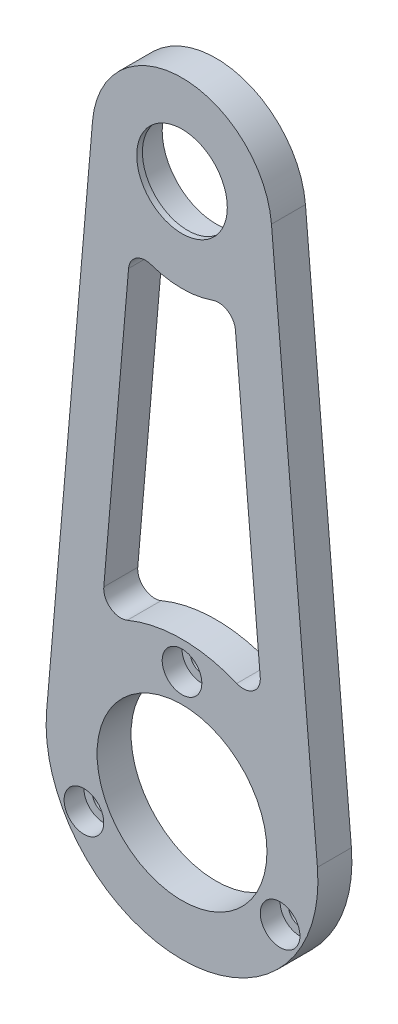
from build123d import *

# Parameters (mm, degrees)
SKETCH_1_R          = 15
SKETCH_1_R_2        = 2
EXTRUDE_1_DEPTH     = 6
FILLET_1_R          = 3
SKETCH_3_R          = 9.5
CUT_EXTRUDE_2_DEPTH = 6
SKETCH_4_R          = 3.5
CUT_EXTRUDE_3_DEPTH = 3.5
EXTRUDE_START       = -1
SKETCH_6_R          = 9.5
SKETCH_6_R_2        = 8
EXTRUDE_3_DEPTH     = 1


with BuildPart() as part:
    # 草图1 → 凸台-拉伸1 (new body)
    with BuildSketch(Plane.XY):
        with BuildLine():
            Line((-23.911674205, 2.057142857), (-15.798784742, 96.359183673))
            ThreePointArc((-15.798784742, 96.359183673), (0, 110.857142857), (15.798784742, 96.359183673))
            Line((15.798784742, 96.359183673), (23.911674205, 2.057142857))
            ThreePointArc((23.911674205, 2.057142857), (0, -24), (-23.911674205, 2.057142857))
        make_face()
        Circle(SKETCH_1_R, mode=Mode.SUBTRACT)
        with Locations((0, 20)):
            Circle(SKETCH_1_R_2, mode=Mode.SUBTRACT)
        with Locations((17.320508076, -10)):
            Circle(SKETCH_1_R_2, mode=Mode.SUBTRACT)
        with Locations((-17.320508076, -10)):
            Circle(SKETCH_1_R_2, mode=Mode.SUBTRACT)
        with BuildLine():
            Line((-14.294598475, 20.510106154), (-9.061440494, 81.338924272))
            ThreePointArc((-9.061440494, 81.338924272), (0, 78.606870528), (9.061440494, 81.338924272))
            Line((9.061440494, 81.338924272), (14.294598475, 20.510106154))
            ThreePointArc((14.294598475, 20.510106154), (0, 25), (-14.294598475, 20.510106154))
        make_face(mode=Mode.SUBTRACT)
    extrude(amount=EXTRUDE_1_DEPTH)

    # 圆角1
    fillet_1_edges = [part.edges().sort_by_distance(p)[0] for p in [
        (-14.294598475, 20.510106154, 3),
        (14.294598475, 20.510106154, 3),
        (9.061440494, 81.338924272, 3),
        (-9.061440494, 81.338924272, 3),
    ]]
    fillet(fillet_1_edges, radius=FILLET_1_R)

    # 草图3 → 切除-拉伸2 (cut)
    with BuildSketch(Plane(origin=(0, 0, 0), x_dir=(-1, 0, 0), z_dir=(0, 0, -1))):
        with Locations((0, 95)):
            Circle(SKETCH_3_R)
    extrude(amount=-CUT_EXTRUDE_2_DEPTH, mode=Mode.SUBTRACT)

    # 草图4 → 切除-拉伸3 (cut)
    with BuildSketch(Plane.XY.offset(6)):
        with Locations((0, 20)):
            Circle(SKETCH_4_R)
        with Locations((17.320508076, -10)):
            Circle(SKETCH_4_R)
        with Locations((-17.320508076, -10)):
            Circle(SKETCH_4_R)
    extrude(amount=-CUT_EXTRUDE_3_DEPTH, mode=Mode.SUBTRACT)

    # 草图6 → 凸台-拉伸3 (add)
    with BuildSketch(Plane.XY.offset(6).offset(EXTRUDE_START)):
        with Locations(Location((0, 95, 0), (0, 0, 180))):
            Circle(SKETCH_6_R)
        with Locations((0, 95)):
            Circle(SKETCH_6_R_2, mode=Mode.SUBTRACT)
    extrude(amount=EXTRUDE_3_DEPTH)


solid = part.part
